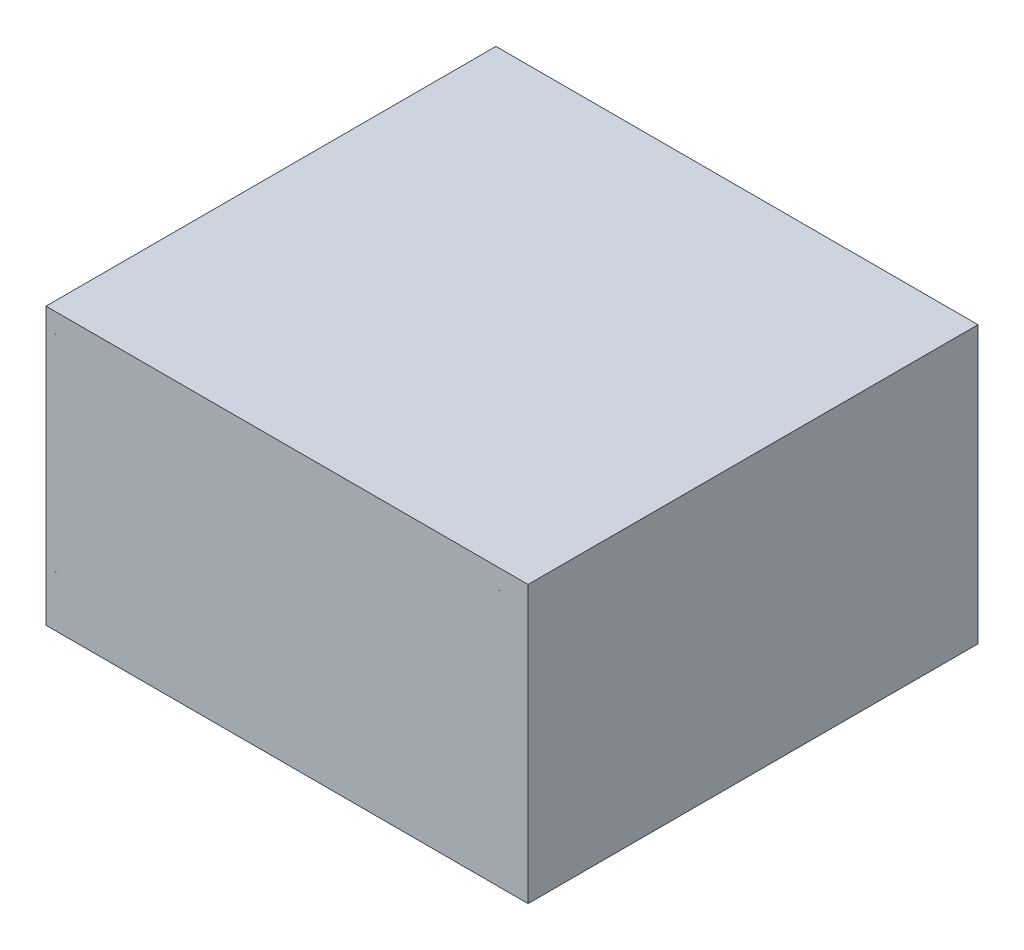
from build123d import *

# Parameters (mm, degrees)
SKETCH_1_W          = 3810
SKETCH_1_H          = 2184.4
EXTRUDE_1_DEPTH     = 3556
SKETCH_1_3_R        = 1.7526
CUT_EXTRUDE_1_DEPTH = 127


with BuildPart() as part:
    # 스케치1 → 보스-돌출1 (new body)
    with BuildSketch(Plane.XY):
        with Locations((1905, 1092.2)):
            Rectangle(SKETCH_1_W, SKETCH_1_H)
    extrude(amount=-EXTRUDE_1_DEPTH)

    # 스케치1<3> → 컷-돌출1 (cut)
    with BuildSketch(Plane.XY):
        with Locations((76.2, 2032)):
            Circle(SKETCH_1_3_R)
        with Locations((3581.4, 2032)):
            Circle(SKETCH_1_3_R)
        with Locations((76.2, 406.4)):
            Circle(SKETCH_1_3_R)
        with Locations((2971.8, 152.4)):
            Circle(SKETCH_1_3_R)
    extrude(amount=-CUT_EXTRUDE_1_DEPTH, mode=Mode.SUBTRACT)


solid = part.part
